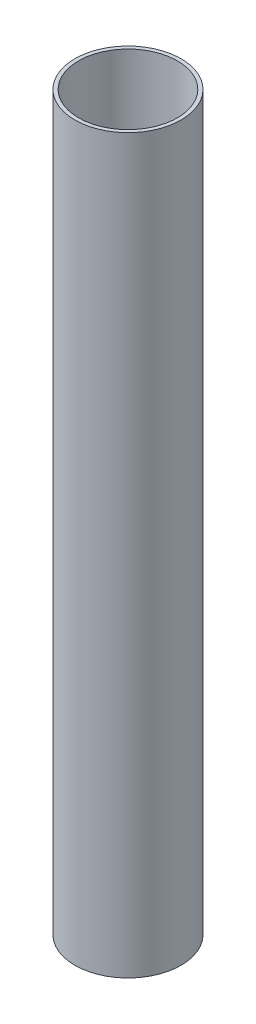
from build123d import *

# Parameters (mm, degrees)
SKETCH1_R           = 29
SKETCH1_R_2         = 27
BOSS_EXTRUDE1_DEPTH = 400


with BuildPart() as part:
    # Sketch1 → Boss-Extrude1 (new body)
    with BuildSketch(Plane(origin=(0, 0, 0), x_dir=(1, 0, 0), z_dir=(0, 1, 0))):
        with Locations(Location((0, 0, 0), (0, 0, 270))):
            Circle(SKETCH1_R)
        with Locations(Location((0, 0, 0), (0, 0, 270))):
            Circle(SKETCH1_R_2, mode=Mode.SUBTRACT)
    extrude(amount=BOSS_EXTRUDE1_DEPTH)


solid = part.part
